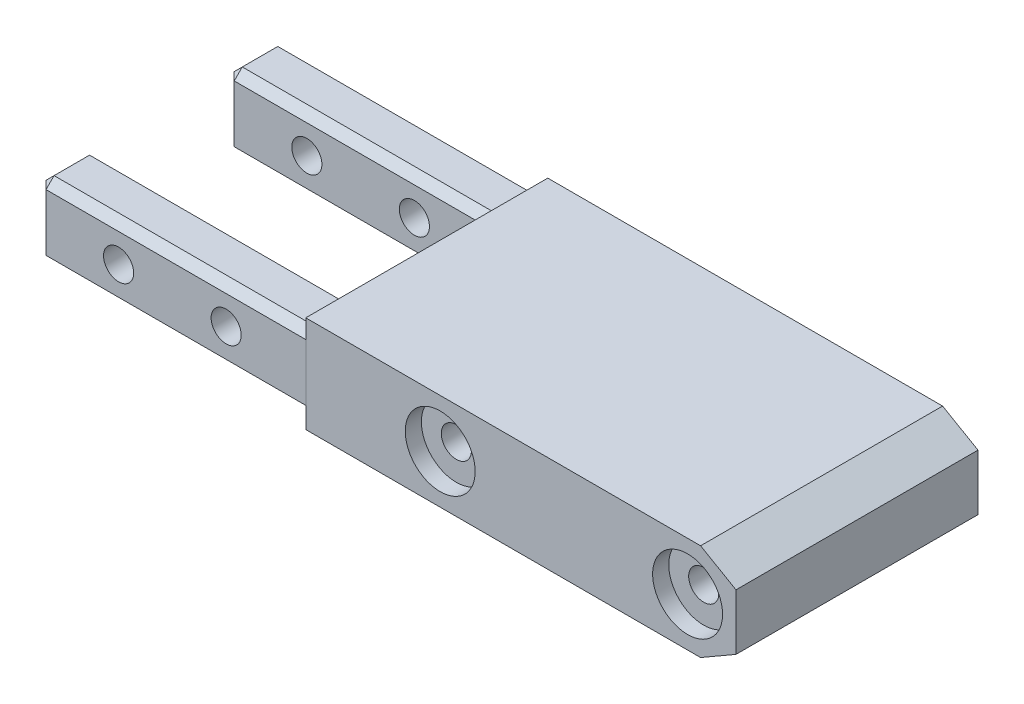
from build123d import *

# Parameters (mm, degrees)
SCHIZZO1_W                                           = 80
SCHIZZO1_H                                           = 18
ESTRUSIONE_ESTRUSIONE1_DEPTH                         = 45
SMUSSO1_SIZE                                         = 3.8
SMUSSO1_SIZE2                                        = 6.581793069
SMUSSO2_SIZE                                         = 3.8
SMUSSO2_SIZE2                                        = 6.581793069
SCHIZZO2_W                                           = 9.6
SCHIZZO2_H                                           = 13.6
ESTRUSIONE_ESTRUSIONE2_DEPTH                         = 50
SMUSSO3_SIZE                                         = 1.5
FORO_PER_VITE_M4_1_D                                 = 5.6
FORO_PER_VITE_M4_1_DEPTH                             = 50
FORO_PER_VITE_M4_1_TIP                               = 1.682409733
FORO_LAMATO_PER_BULLONE_M5_A_TESTA_ESAGO_D           = 5.6
FORO_LAMATO_PER_BULLONE_M5_A_TESTA_ESAGO_DEPTH       = 50
FORO_LAMATO_PER_BULLONE_M5_A_TESTA_ESAGO_CBORE_D     = 13
FORO_LAMATO_PER_BULLONE_M5_A_TESTA_ESAGO_CBORE_DEPTH = 3
FORO_LAMATO_PER_BULLONE_M5_A_TESTA_ESAGO_TIP         = 1.682409733
FORO_LAMATO_PER_BULLONE_M5_A_TESTA_E_2_D             = 5.6
FORO_LAMATO_PER_BULLONE_M5_A_TESTA_E_2_DEPTH         = 50
FORO_LAMATO_PER_BULLONE_M5_A_TESTA_E_2_CBORE_D       = 13
FORO_LAMATO_PER_BULLONE_M5_A_TESTA_E_2_CBORE_DEPTH   = 3
FORO_LAMATO_PER_BULLONE_M5_A_TESTA_E_2_TIP           = 1.682409733


with BuildPart() as part:
    # Schizzo1 → Estrusione-Estrusione1 (new body)
    with BuildSketch(Plane.XY):
        with Locations((-40, 9)):
            Rectangle(SCHIZZO1_W, SCHIZZO1_H)
    extrude(amount=ESTRUSIONE_ESTRUSIONE1_DEPTH)

    # Smusso1
    smusso1_edges = [part.edges().sort_by_distance(p)[0] for p in [
        (0, 18, 22.5),
    ]]
    smusso1_side = [part.faces().sort_by_distance(p)[0] for p in [
        (0, 9, 22.5),
    ]]
    chamfer(smusso1_edges, length=SMUSSO1_SIZE, length2=SMUSSO1_SIZE2, reference=smusso1_side[0])

    # Smusso2
    smusso2_edges = [part.edges().sort_by_distance(p)[0] for p in [
        (0, 0, 22.5),
    ]]
    smusso2_side = [part.faces().sort_by_distance(p)[0] for p in [
        (0, 7.1, 22.5),
    ]]
    chamfer(smusso2_edges, length=SMUSSO2_SIZE, length2=SMUSSO2_SIZE2, reference=smusso2_side[0])

    # Schizzo2 → Estrusione-Estrusione2 (add)
    with BuildSketch(Plane.ZY.offset(80)):
        with Locations((5, 9)):
            Rectangle(SCHIZZO2_W, SCHIZZO2_H)
        with Locations((40, 9)):
            Rectangle(SCHIZZO2_W, SCHIZZO2_H)
    extrude(amount=ESTRUSIONE_ESTRUSIONE2_DEPTH)

    # Smusso3
    smusso3_edges = [part.edges().sort_by_distance(p)[0] for p in [
        (-105, 15.8, 0.2),
        (-105, 2.2, 0.2),
        (-105, 2.2, 9.8),
        (-105, 15.8, 9.8),
        (-130, 9, 0.2),
        (-130, 2.2, 5),
        (-130, 9, 9.8),
        (-130, 15.8, 5),
        (-105, 15.8, 35.2),
        (-105, 2.2, 35.2),
        (-105, 2.2, 44.8),
        (-105, 15.8, 44.8),
        (-130, 9, 35.2),
        (-130, 2.2, 40),
        (-130, 9, 44.8),
        (-130, 15.8, 40),
    ]]
    chamfer(smusso3_edges, length=SMUSSO3_SIZE)

    # Foro per Vite M4-1
    with Locations(Plane(origin=(-115, 9, 0.2), x_dir=(0, -1, 0), z_dir=(0, 0, -1))):
        with Locations((0, 0), (0, -20)):
            Hole(FORO_PER_VITE_M4_1_D / 2, depth=FORO_PER_VITE_M4_1_DEPTH)
            with Locations((0, 0, -(FORO_PER_VITE_M4_1_DEPTH + FORO_PER_VITE_M4_1_TIP / 2))):  # 118° drill point
                Cone(0, FORO_PER_VITE_M4_1_D / 2, FORO_PER_VITE_M4_1_TIP, mode=Mode.SUBTRACT)

    # Foro lamato per Bullone M5 a testa esago
    with Locations(Plane.XY.offset(45)):
        with Locations((-9, 9), (-55, 9)):
            CounterBoreHole(FORO_LAMATO_PER_BULLONE_M5_A_TESTA_ESAGO_D / 2, FORO_LAMATO_PER_BULLONE_M5_A_TESTA_ESAGO_CBORE_D / 2, FORO_LAMATO_PER_BULLONE_M5_A_TESTA_ESAGO_CBORE_DEPTH, depth=FORO_LAMATO_PER_BULLONE_M5_A_TESTA_ESAGO_DEPTH)
            with Locations((0, 0, -(FORO_LAMATO_PER_BULLONE_M5_A_TESTA_ESAGO_DEPTH + FORO_LAMATO_PER_BULLONE_M5_A_TESTA_ESAGO_TIP / 2))):  # 118° drill point
                Cone(0, FORO_LAMATO_PER_BULLONE_M5_A_TESTA_ESAGO_D / 2, FORO_LAMATO_PER_BULLONE_M5_A_TESTA_ESAGO_TIP, mode=Mode.SUBTRACT)

    # Foro lamato per Bullone M5 a testa e 2
    with Locations(Plane(origin=(-9, 9, 0), x_dir=(-1, 0, 0), z_dir=(0, 0, -1))):
        with Locations((0, 0), (46, 0)):
            CounterBoreHole(FORO_LAMATO_PER_BULLONE_M5_A_TESTA_E_2_D / 2, FORO_LAMATO_PER_BULLONE_M5_A_TESTA_E_2_CBORE_D / 2, FORO_LAMATO_PER_BULLONE_M5_A_TESTA_E_2_CBORE_DEPTH, depth=FORO_LAMATO_PER_BULLONE_M5_A_TESTA_E_2_DEPTH)
            with Locations((0, 0, -(FORO_LAMATO_PER_BULLONE_M5_A_TESTA_E_2_DEPTH + FORO_LAMATO_PER_BULLONE_M5_A_TESTA_E_2_TIP / 2))):  # 118° drill point
                Cone(0, FORO_LAMATO_PER_BULLONE_M5_A_TESTA_E_2_D / 2, FORO_LAMATO_PER_BULLONE_M5_A_TESTA_E_2_TIP, mode=Mode.SUBTRACT)


solid = part.part
